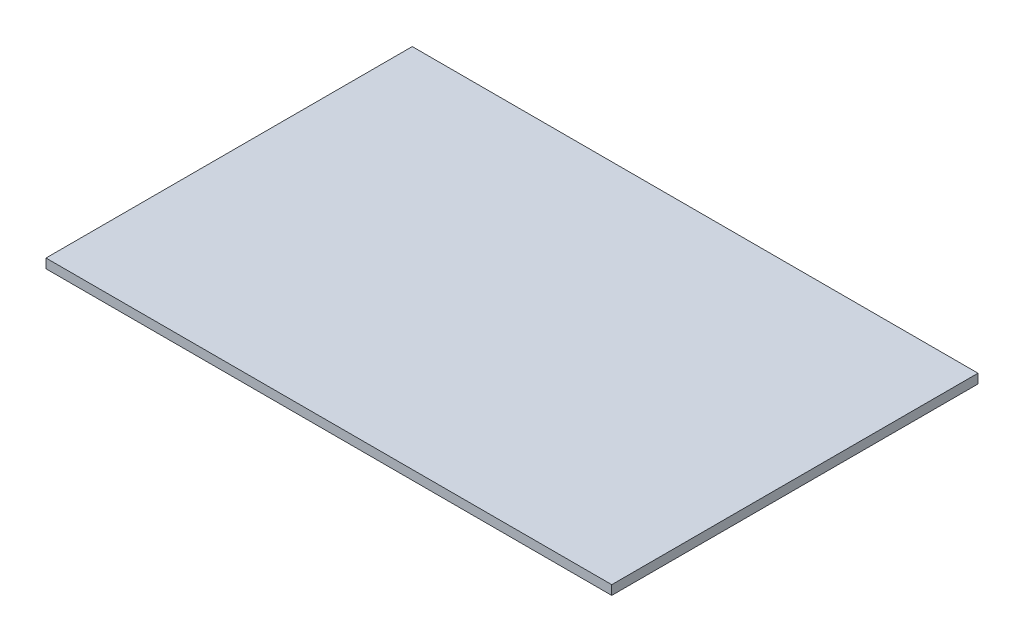
from build123d import *

# Parameters (mm, degrees)
SKETCH1_W           = 726
SKETCH1_H           = 470
BOSS_EXTRUDE1_DEPTH = 12


with BuildPart() as part:
    # Sketch1 → Boss-Extrude1 (new body)
    with BuildSketch(Plane(origin=(0, 0, 0), x_dir=(1, 0, 0), z_dir=(0, 1, 0))):
        Rectangle(SKETCH1_W, SKETCH1_H)
    extrude(amount=BOSS_EXTRUDE1_DEPTH)


solid = part.part
